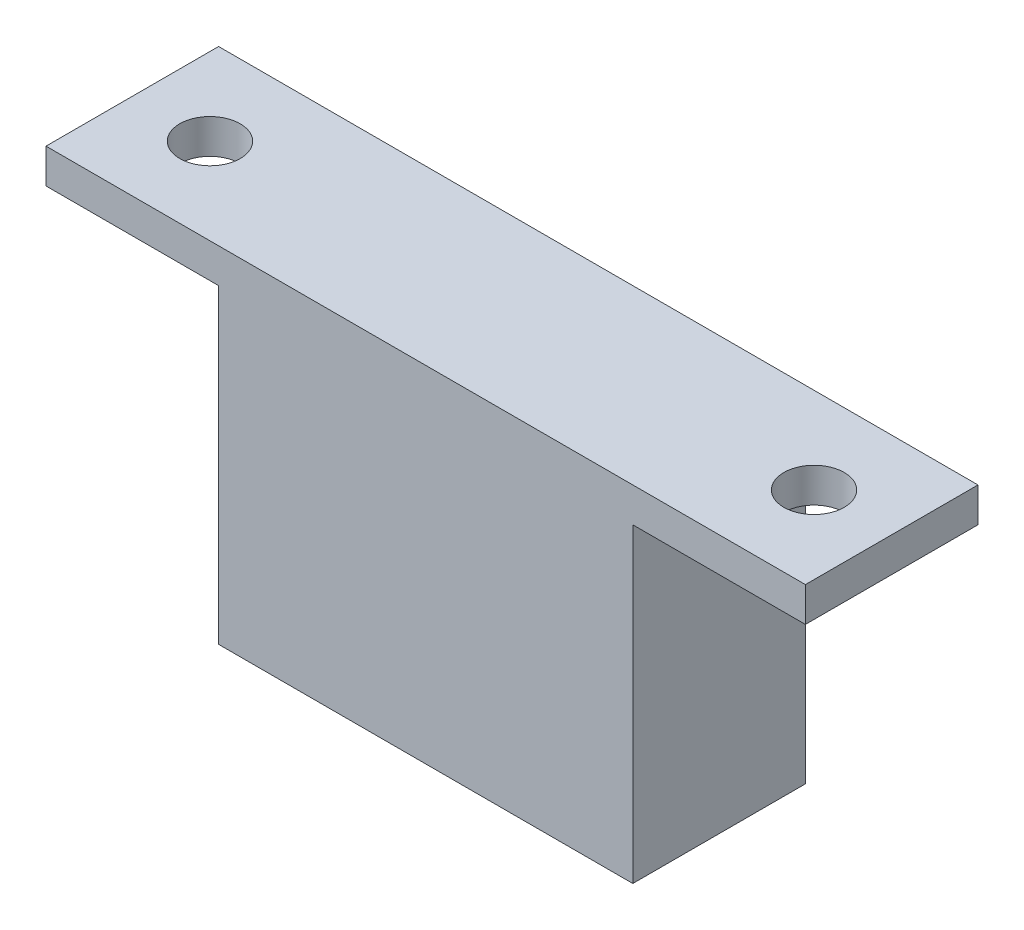
from build123d import *

# Parameters (mm, degrees)
RESSALTO_EXTRUS_O1_DEPTH = 10
ESBO_O2_R                = 1.75
CORTE_EXTRUS_O1_DEPTH    = 10


with BuildPart() as part:
    # Esboço1 → Ressalto-extrusão1 (new body)
    with BuildSketch(Plane.XY):
        Polygon((-12, 5), (-22, 5), (-22, 3), (-12, 3), (-12, -15), (12, -15), (12, 3), (22, 3), (22, 5), (12, 5), align=None)
    extrude(amount=RESSALTO_EXTRUS_O1_DEPTH)

    # Esboço2 → Corte-extrusão1 (cut)
    with BuildSketch(Plane(origin=(0, 5, 0), x_dir=(1, 0, 0), z_dir=(0, 1, 0))):
        with Locations(Location((-17.5, -5, 0), (0, 0, 180))):
            Circle(ESBO_O2_R)
        with Locations(Location((17.5, -5, 0), (0, 0, 180))):
            Circle(ESBO_O2_R)
    extrude(amount=-CORTE_EXTRUS_O1_DEPTH, mode=Mode.SUBTRACT)


solid = part.part
